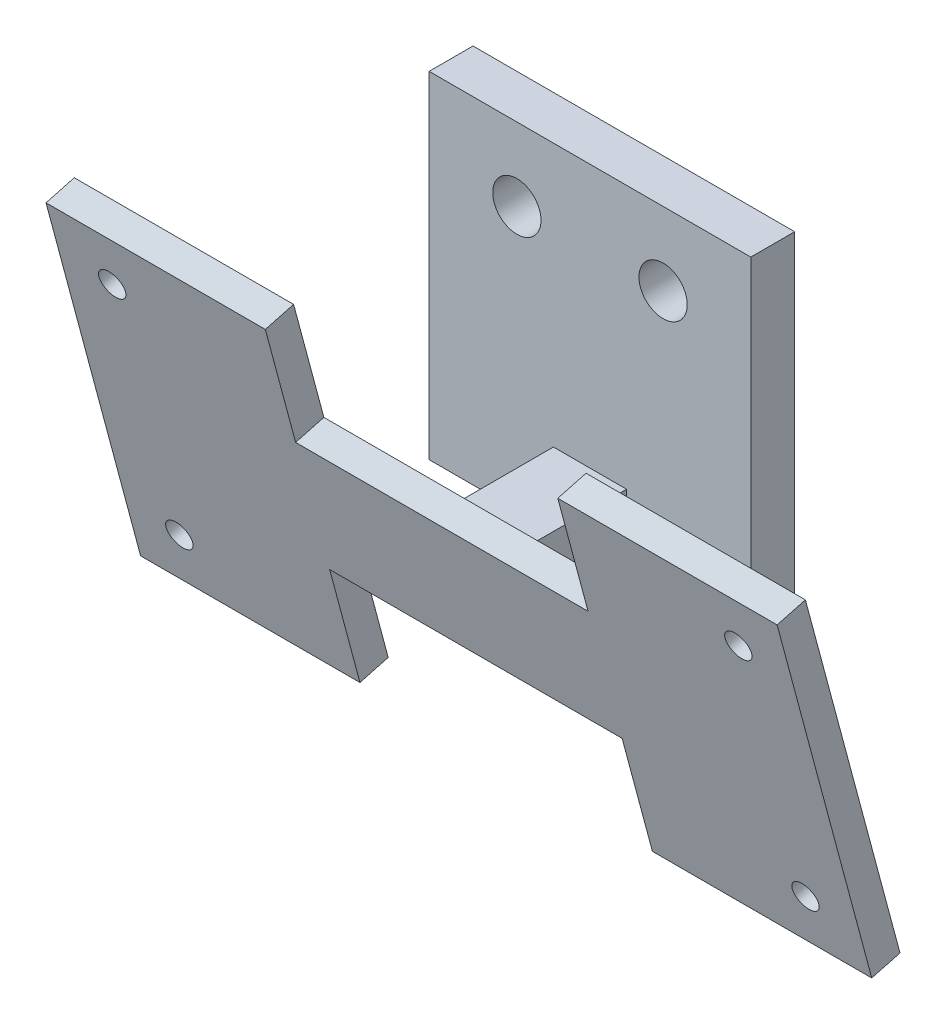
from build123d import *

# Parameters (mm, degrees)
SKETCH_1_W          = 22
SKETCH_1_H          = 10
SKETCH_1_R          = 1.65
EXTRUDE_1_DEPTH     = 3
SKETCH_2_W          = 22
SKETCH_2_H          = 3
EXTRUDE_2_DEPTH     = 13
SKETCH_4_W          = 5
SKETCH_4_H          = 5
EXTRUDE_3_DEPTH     = 8
EXTRUDE_4_DEPTH     = 25
SKETCH_7_R          = 0.91
CUT_EXTRUDE_1_DEPTH = 30
SKETCH_8_W          = 20
SKETCH_8_H          = 8
CUT_EXTRUDE_2_DEPTH = 5


with BuildPart() as part:
    # 草图1 → 凸台-拉伸1 (new body)
    with BuildSketch(Plane.XY):
        Rectangle(SKETCH_1_W, SKETCH_1_H)
        with Locations((-5, 0)):
            Circle(SKETCH_1_R, mode=Mode.SUBTRACT)
        with Locations(Location((5, 0, 0), (0, 0, 180))):
            Circle(SKETCH_1_R, mode=Mode.SUBTRACT)
    extrude(amount=EXTRUDE_1_DEPTH)

    # 草图2 → 凸台-拉伸2 (add)
    with BuildSketch(Plane.XZ.offset(5)):
        with Locations((0, 1.5)):
            Rectangle(SKETCH_2_W, SKETCH_2_H)
    extrude(amount=EXTRUDE_2_DEPTH)

    # 草图4 → 凸台-拉伸3 (add)
    with BuildSketch(Plane.XY.offset(3)):
        with Locations((0, -15.5)):
            Rectangle(SKETCH_4_W, SKETCH_4_H)
    extrude(amount=EXTRUDE_3_DEPTH)

    # 草图6 → 凸台-拉伸4 (add, symmetric)
    with BuildSketch(Plane.ZY):
        Polygon((6.79883611, -27.315253784), (13.269312237, -3.167108126), (15.20116389, -3.684746216), (8.730687763, -27.832891874), align=None)
    extrude(amount=EXTRUDE_4_DEPTH, both=True)

    # 草图7 → 切除-拉伸1 (cut)
    with BuildSketch(Plane(origin=(0, -4.047122166, 15.104065547), x_dir=(1, 0, 0), z_dir=(0, -0.25881904510251497, 0.9659258262890699))):
        with Locations(Location((-21.41, -3.254840811, 0), (0, 0, 270))):
            Circle(SKETCH_7_R)
        with Locations(Location((21.41, -3.254840811, 0), (0, 0, 270))):
            Circle(SKETCH_7_R)
        with Locations(Location((21.41, -20.994840811, 0), (0, 0, 270))):
            Circle(SKETCH_7_R)
        with Locations(Location((-21.41, -20.994840811, 0), (0, 0, 270))):
            Circle(SKETCH_7_R)
    extrude(amount=-CUT_EXTRUDE_1_DEPTH, mode=Mode.SUBTRACT)

    # 草图8 → 切除-拉伸2 (cut)
    with BuildSketch(Plane(origin=(0, -4.047122166, 15.104065547), x_dir=(1, 0, 0), z_dir=(0, -0.25881904510251497, 0.9659258262890699))):
        with Locations((0, -3.624840811)):
            Rectangle(SKETCH_8_W, SKETCH_8_H)
        with Locations((0, -20.624840811)):
            Rectangle(SKETCH_8_W, SKETCH_8_H)
    extrude(amount=-CUT_EXTRUDE_2_DEPTH, mode=Mode.SUBTRACT)


solid = part.part
